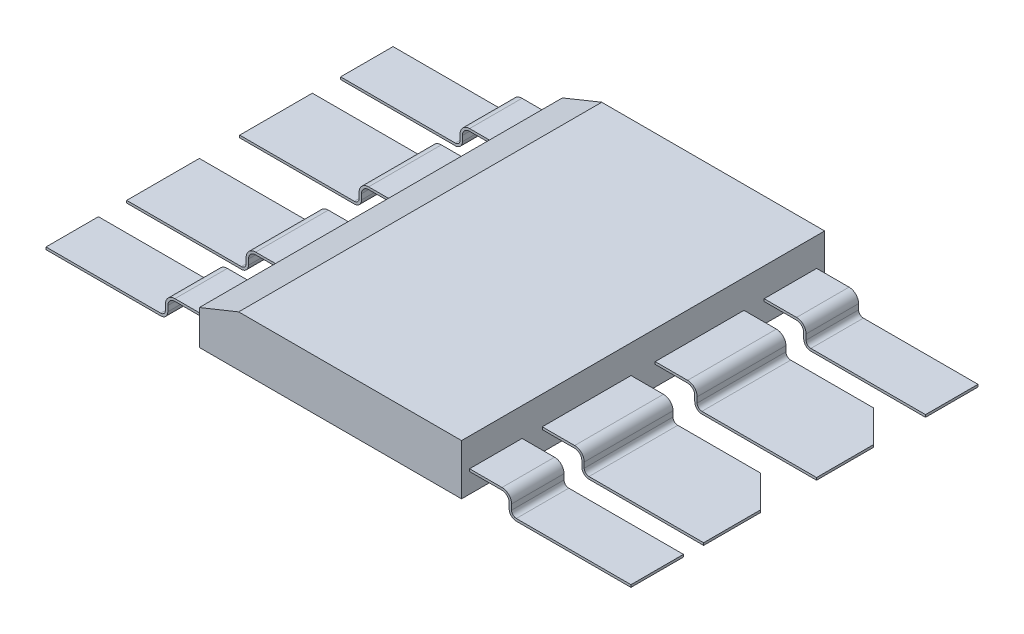
from build123d import *

# Parameters (mm, degrees)
SKETCH_1_W      = 16.51
SKETCH_1_H      = 22.86
EXTRUDE_1_DEPTH = 3.18
CHAMFER_1_SIZE  = 1
CHAMFER_1_SIZE2 = 2.475086853
SKETCH_2_W      = 3.305
SKETCH_2_H      = 0.15
SKETCH_2_W_2    = 5.59
SKETCH_4_W      = 3.3
SKETCH_4_H      = 0.15
SKETCH_4_W_2    = 4.575
CHAMFER_2_SIZE  = 2


with BuildPart() as part:
    # Эскиз1 → Бобышка-Вытянуть1 (new body)
    with BuildSketch(Plane(origin=(0, 0, 0), x_dir=(1, 0, 0), z_dir=(0, 1, 0))):
        Rectangle(SKETCH_1_W, SKETCH_1_H)
    extrude(amount=EXTRUDE_1_DEPTH)

    # Фаска1
    chamfer_1_edges = [part.edges().sort_by_distance(p)[0] for p in [
        (-8.255, 3.18, 0),
    ]]
    chamfer_1_side = [part.faces().sort_by_distance(p)[0] for p in [
        (-8.255, 1.59, 0),
    ]]
    chamfer(chamfer_1_edges, length=CHAMFER_1_SIZE, length2=CHAMFER_1_SIZE2, reference=chamfer_1_side[0])

    # По траектории1: sweep along a path in Эскиз3
    with BuildLine(Plane.XY) as sweep_1_path:
        Line((18.415, 0), (11.196173743, 0))
        ThreePointArc((11.196173743, 0), (10.877975692, 0.131801948), (10.746173743, 0.45))
        Line((10.746173743, 0.45), (10.746173743, 0.79))
        ThreePointArc((10.746173743, 0.79), (10.614371795, 1.108198052), (10.296173743, 1.24))
        Line((10.296173743, 1.24), (8.255, 1.24))
    # Эскиз2 → По траектории1 (sweep)
    with BuildSketch(Plane(origin=(8.255, 0, 0), x_dir=(0, 0, -1), z_dir=(1, 0, 0))):
        with Locations((-9.2725, 1.315)):
            Rectangle(SKETCH_2_W, SKETCH_2_H)
        with Locations((-3.555, 1.315)):
            Rectangle(SKETCH_2_W_2, SKETCH_2_H)
        with Locations((3.555, 1.315)):
            Rectangle(SKETCH_2_W_2, SKETCH_2_H)
        with Locations((9.2725, 1.315)):
            Rectangle(SKETCH_2_W, SKETCH_2_H)
    sweep(path=sweep_1_path.line)

    # По траектории2: sweep along a path in Эскиз5
    with BuildLine(Plane.XY) as sweep_2_path:
        Line((-8.255, 1.24), (-10.296173743, 1.24))
        ThreePointArc((-10.296173743, 1.24), (-10.614371795, 1.108198052), (-10.746173743, 0.79))
        Line((-10.746173743, 0.79), (-10.746173743, 0.45))
        ThreePointArc((-10.746173743, 0.45), (-10.877975692, 0.131801948), (-11.196173743, 0))
        Line((-11.196173743, 0), (-18.415, 0))
    # Эскиз4 → По траектории2 (sweep)
    with BuildSketch(Plane.ZY.offset(8.255)):
        with Locations((-9.275, 1.315)):
            Rectangle(SKETCH_4_W, SKETCH_4_H)
        with Locations((-3.5575, 1.315)):
            Rectangle(SKETCH_4_W_2, SKETCH_4_H)
        with Locations((3.5575, 1.315)):
            Rectangle(SKETCH_4_W_2, SKETCH_4_H)
        with Locations((9.275, 1.315)):
            Rectangle(SKETCH_4_W, SKETCH_4_H)
    sweep(path=sweep_2_path.line)

    # Фаска2
    chamfer_2_edges = [part.edges().sort_by_distance(p)[0] for p in [
        (18.415, 0.075, 0.76),
        (18.415, 0.075, -6.35),
    ]]
    chamfer(chamfer_2_edges, length=CHAMFER_2_SIZE)


solid = part.part
